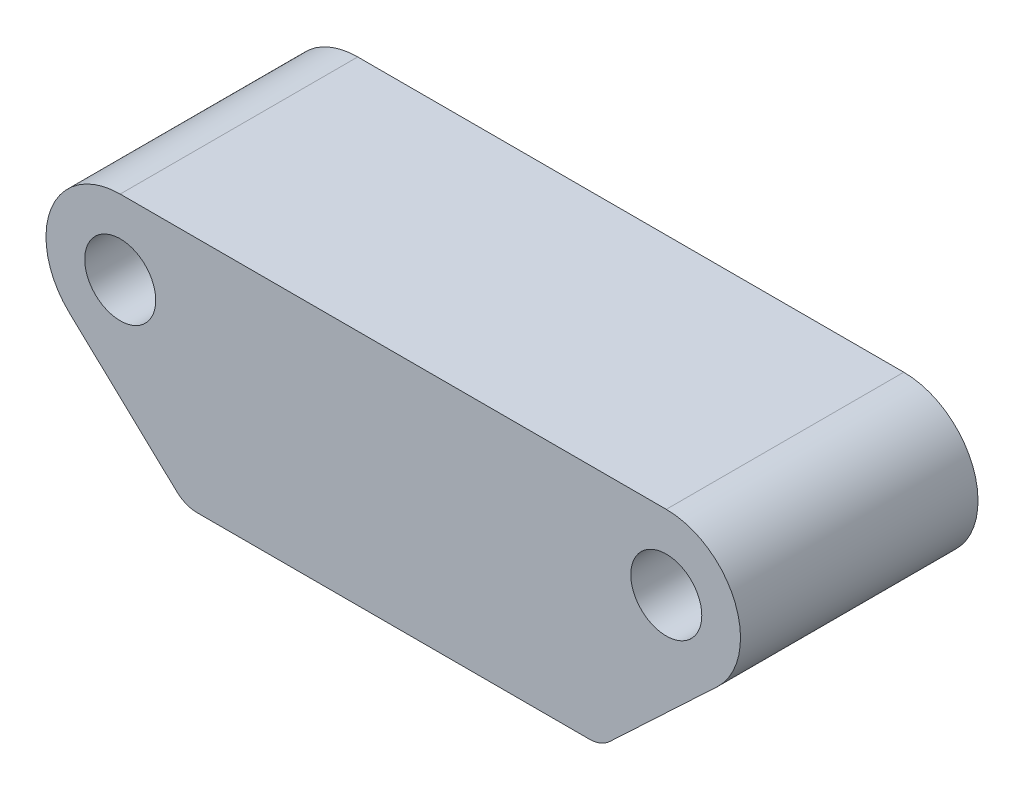
from build123d import *

# Parameters (mm, degrees)
SKETCH1_R             = 1.89865
BOSS_EXTRUDE1_DEPTH   = 12.7
FILLET1_R             = 1.5875
F_6_CLEARANCE_HOLE1_D = 3.7973


with BuildPart() as part:
    # Sketch1 → Boss-Extrude1 (new body)
    with BuildSketch(Plane.XY):
        with BuildLine():
            Line((-17.318712187, -0.508773921), (-11.1125, -6.35))
            Line((-11.1125, -6.35), (11.1125, -6.35))
            Line((11.1125, -6.35), (17.318712187, -0.508773921))
            ThreePointArc((17.318712187, -0.508773921), (18.287874783, 3.844327942), (14.59865, 6.35))
            Line((14.59865, 6.35), (12.7, 6.35))
            Line((12.7, 6.35), (-12.7, 6.35))
            Line((-12.7, 6.35), (-14.59865, 6.35))
            ThreePointArc((-14.59865, 6.35), (-18.287874783, 3.844327942), (-17.318712187, -0.508773921))
        make_face()
        with Locations((-14.59865, 2.38125)):
            Circle(SKETCH1_R, mode=Mode.SUBTRACT)
    extrude(amount=BOSS_EXTRUDE1_DEPTH)

    # Fillet1
    fillet1_edges = [part.edges().sort_by_distance(p)[0] for p in [
        (11.1125, -6.35, 6.35),
        (-11.1125, -6.35, 6.35),
    ]]
    fillet(fillet1_edges, radius=FILLET1_R)

    # #6 Clearance Hole1 (through all)
    with Locations(Plane.XY.offset(12.7)):
        with Locations((-14.59865, 2.38125), (14.59865, 2.38125)):
            Hole(F_6_CLEARANCE_HOLE1_D / 2)


solid = part.part
